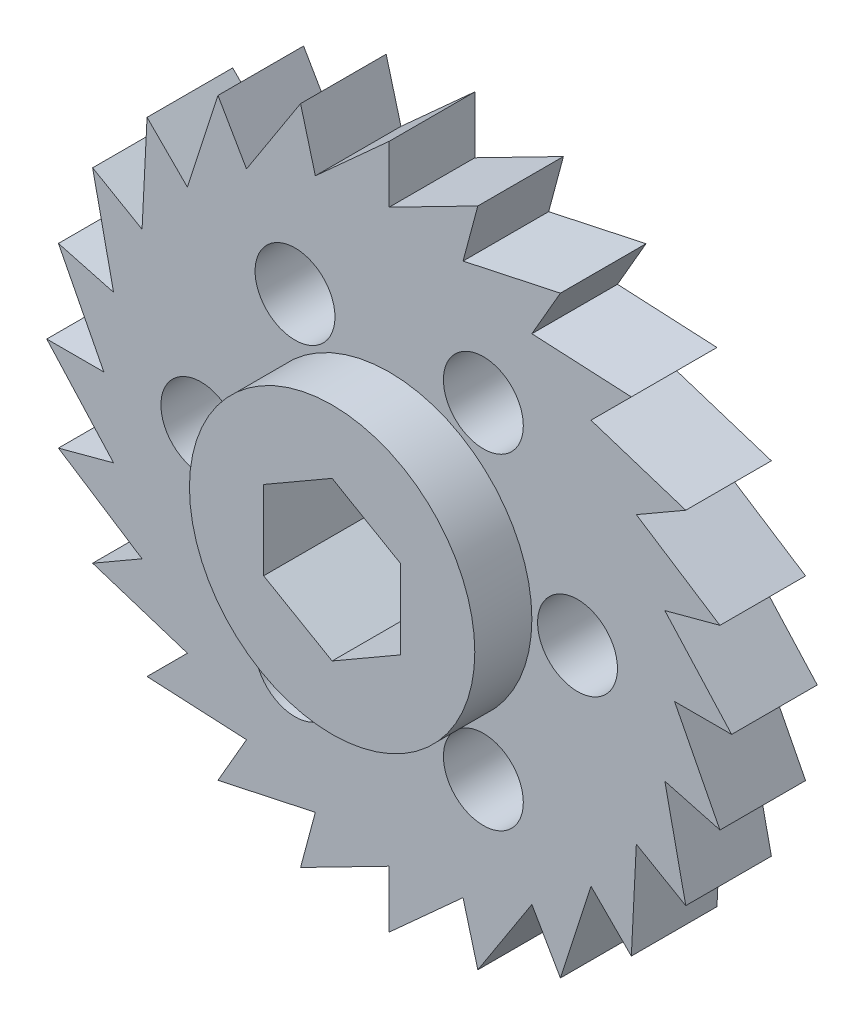
from build123d import *

# Parameters (mm, degrees)
EXTRUDE_1_DEPTH     = 15
SKETCH_2_R          = 25
EXTRUDE_2_DEPTH     = 10
CUT_EXTRUDE_1_DEPTH = 121
SKETCH_4_R          = 7
CUT_EXTRUDE_2_DEPTH = 121


with BuildPart() as part:
    # 草图1 → 凸台-拉伸1 (new body)
    with BuildSketch(Plane.XY):
        Polygon((50, 0), (60, 0), (48.29629, 12.94095), (57.95555, 15.52914), (43.30127, 25), (51.96152, 30), (35.35534, 35.35534), (42.42641, 42.42641), (25, 43.30127), (30, 51.96152), (12.94095, 48.29629), (15.52914, 57.95555), (0, 50), (0, 60), (-12.94095, 48.29629), (-15.52914, 57.95555), (-25, 43.30127), (-30, 51.96152), (-35.35534, 35.35534), (-42.42641, 42.42641), (-43.30127, 25), (-51.96152, 30), (-48.29629, 12.94095), (-57.95555, 15.52914), (-50, 0), (-60, 0), (-48.29629, -12.94095), (-57.95555, -15.52914), (-43.30127, -25), (-51.96152, -30), (-35.35534, -35.35534), (-42.42641, -42.42641), (-25, -43.30127), (-30, -51.96152), (-12.94095, -48.29629), (-15.52914, -57.95555), (0, -50), (0, -60), (12.94095, -48.29629), (15.52914, -57.95555), (25, -43.30127), (30, -51.96152), (35.35534, -35.35534), (42.42641, -42.42641), (43.30127, -25), (51.96152, -30), (48.29629, -12.94095), (57.95555, -15.52914), align=None)
    extrude(amount=EXTRUDE_1_DEPTH)

    # 草图2 → 凸台-拉伸2 (add)
    with BuildSketch(Plane.XY.offset(15)):
        Circle(SKETCH_2_R)
    extrude(amount=EXTRUDE_2_DEPTH)

    # 草图3 → 切除-拉伸1 (cut, symmetric)
    with BuildSketch(Plane.XY.offset(25)):
        Polygon((12, 6.92820323), (0, 13.856406461), (-12, 6.92820323), (-12, -6.92820323), (0, -13.856406461), (12, -6.92820323), align=None)
    extrude(amount=CUT_EXTRUDE_1_DEPTH, both=True, mode=Mode.SUBTRACT)

    # 草图4 → 切除-拉伸2 (cut, symmetric)
    with BuildSketch(Plane.XY.offset(15)):
        with Locations((33, 0)):
            Circle(SKETCH_4_R)
        with Locations((16.5, 28.578838)):
            Circle(SKETCH_4_R)
        with Locations((-16.5, 28.578838)):
            Circle(SKETCH_4_R)
        with Locations((-33, 0)):
            Circle(SKETCH_4_R)
        with Locations((-16.5, -28.578838)):
            Circle(SKETCH_4_R)
        with Locations((16.5, -28.578838)):
            Circle(SKETCH_4_R)
    extrude(amount=CUT_EXTRUDE_2_DEPTH, both=True, mode=Mode.SUBTRACT)


solid = part.part
